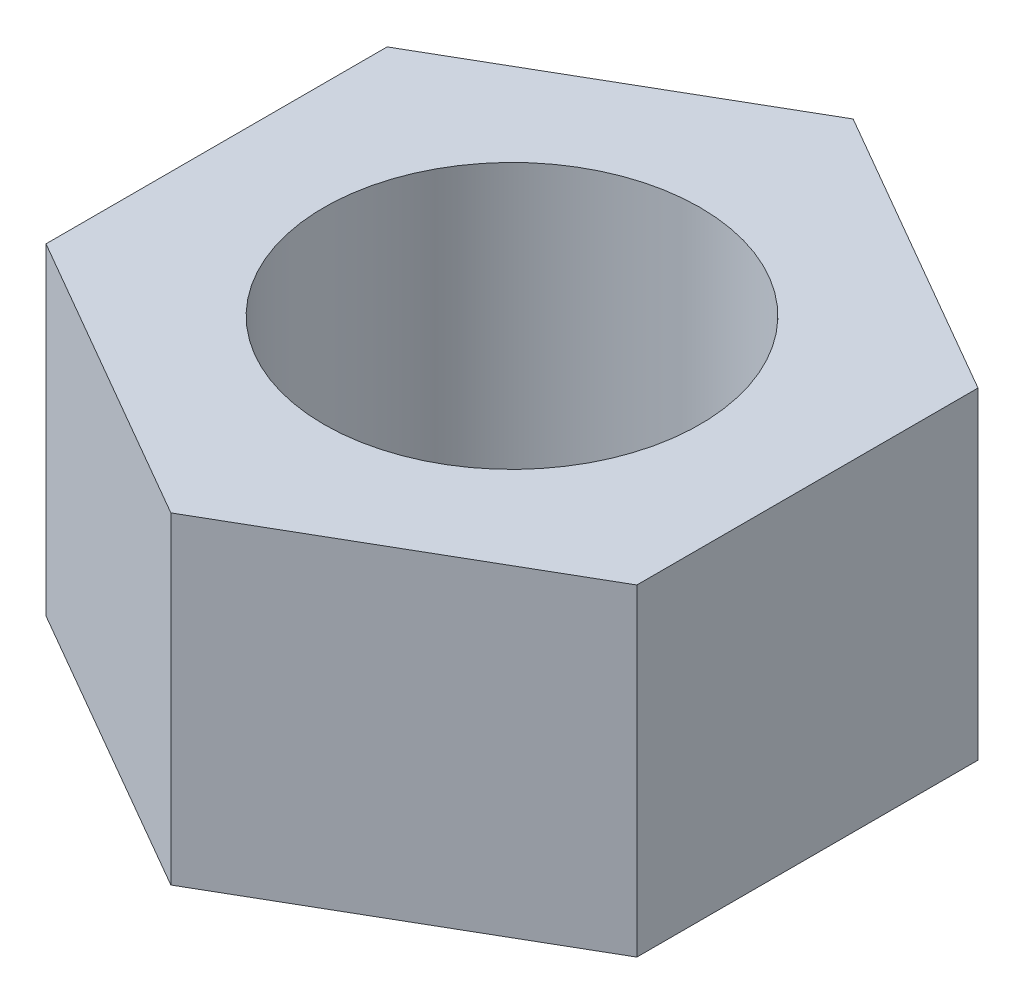
from build123d import *

# Parameters (mm, degrees)
BOSS_EXTRUDE1_DEPTH = 6
SKETCH2_R           = 3.5
CUT_EXTRUDE1_DEPTH  = 6


with BuildPart() as part:
    # Sketch1 → Boss-Extrude1 (new body)
    with BuildSketch(Plane(origin=(0, 0, 0), x_dir=(1, 0, 0), z_dir=(0, 1, 0))):
        Polygon((0, 6.350852961), (-5.5, 3.175426481), (-5.5, -3.175426481), (0, -6.350852961), (5.5, -3.175426481), (5.5, 3.175426481), align=None)
    extrude(amount=BOSS_EXTRUDE1_DEPTH)

    # Sketch2 → Cut-Extrude1 (cut)
    with BuildSketch(Plane(origin=(0, 6, 0), x_dir=(1, 0, 0), z_dir=(0, 1, 0))):
        with Locations(Location((0, 0, 0), (0, 0, 270))):
            Circle(SKETCH2_R)
    extrude(amount=-CUT_EXTRUDE1_DEPTH, mode=Mode.SUBTRACT)


solid = part.part
